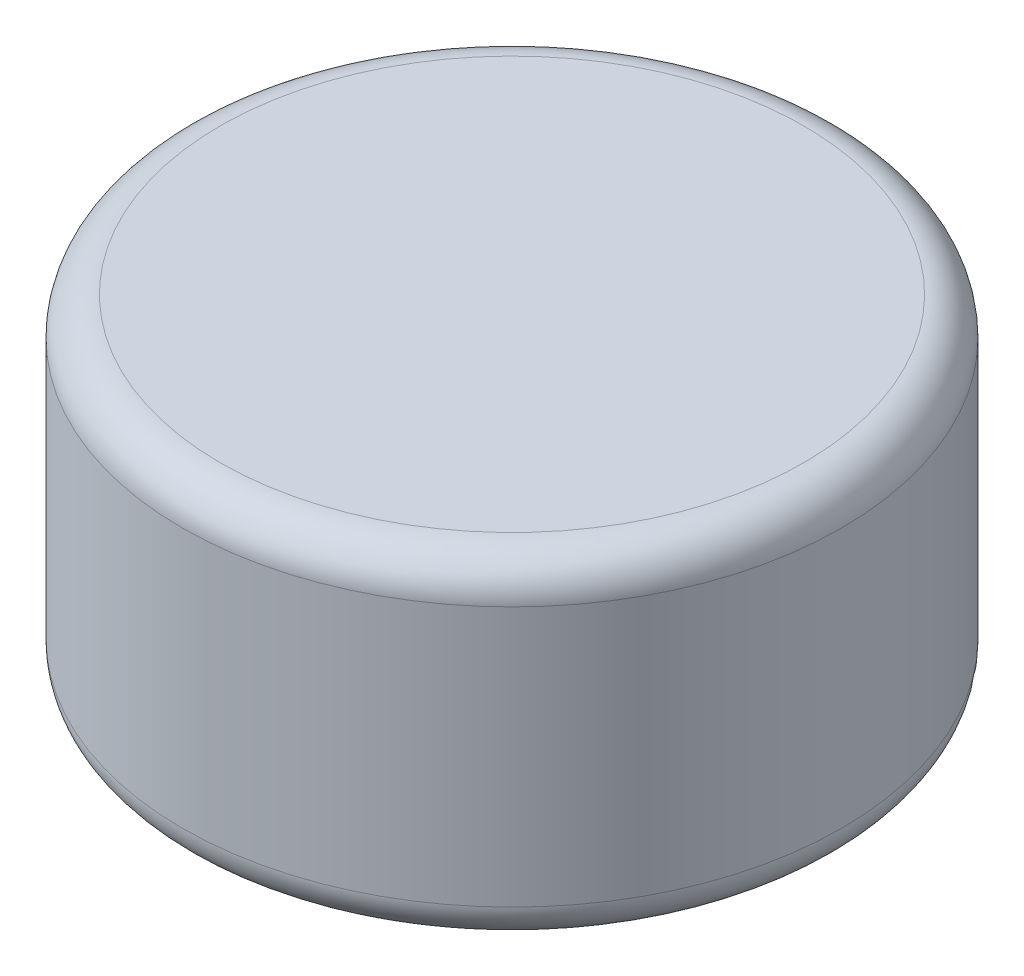
from build123d import *

# Parameters (mm, degrees)
SCHIZZO1_R                   = 349.25
ESTRUSIONE_ESTRUSIONE1_DEPTH = 355.6
RACCORDO1_R                  = 40
SCHIZZO2_R                   = 65.5
TAGLIO_ESTRUSIONE1_DEPTH     = 136


with BuildPart() as part:
    # Schizzo1 → Estrusione-Estrusione1 (new body)
    with BuildSketch(Plane(origin=(0, 0, 0), x_dir=(-1, 0, 0), z_dir=(0, 1, 0))):
        with Locations(Location((0, 0, 0), (0, 0, 90))):
            Circle(SCHIZZO1_R)
    extrude(amount=ESTRUSIONE_ESTRUSIONE1_DEPTH)

    # Raccordo1
    raccordo1_edges = [part.edges().sort_by_distance(p)[0] for p in [
        (0, 0, -349.25),
        (0, 355.6, -349.25),
    ]]
    fillet(raccordo1_edges, radius=RACCORDO1_R)

    # Schizzo2 → Taglio-Estrusione1 (cut)
    with BuildSketch(Plane.XZ):
        with Locations(Location((0, 0, 0), (0, 0, 270))):
            Circle(SCHIZZO2_R)
    extrude(amount=-TAGLIO_ESTRUSIONE1_DEPTH, mode=Mode.SUBTRACT)


solid = part.part
